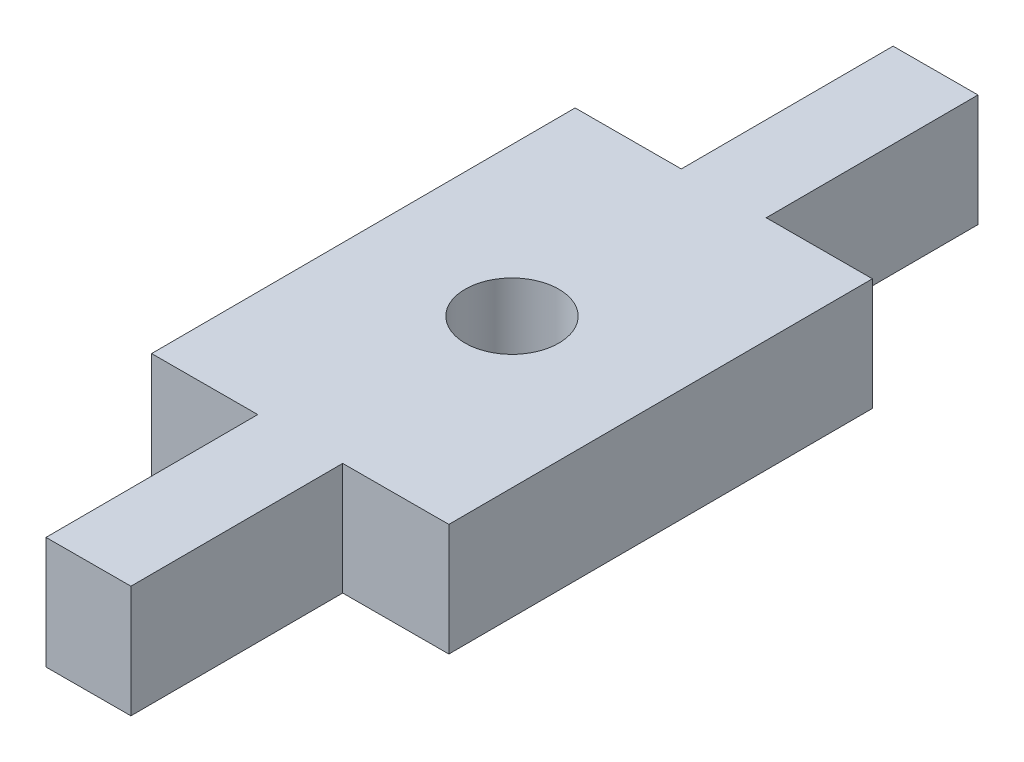
from build123d import *

# Parameters (mm, degrees)
SKETCH1_R           = 1.323683328
BOSS_EXTRUDE1_DEPTH = 3.175


with BuildPart() as part:
    # Sketch1 → Boss-Extrude1 (new body)
    with BuildSketch(Plane(origin=(0, 0, 0), x_dir=(1, 0, 0), z_dir=(0, 1, 0))):
        Polygon((-1.184335339, -6.002939565), (-1.170921212, -12.003227579), (1.224840933, -11.997729152), (1.211295199, -5.997499736), (4.206013721, -5.990594961), (4.179180593, 6.009727143), (1.184462071, 6.003007929), (1.17111131, 12.003227579), (-1.224524102, 11.99778775), (-1.211105101, 5.9975681), (-4.206013721, 5.990848885), (-4.179058735, -6.00947322), align=None)
        with Locations(Location((0, 0, 0), (0, 0, 270))):
            Circle(SKETCH1_R, mode=Mode.SUBTRACT)
    extrude(amount=BOSS_EXTRUDE1_DEPTH)


solid = part.part
